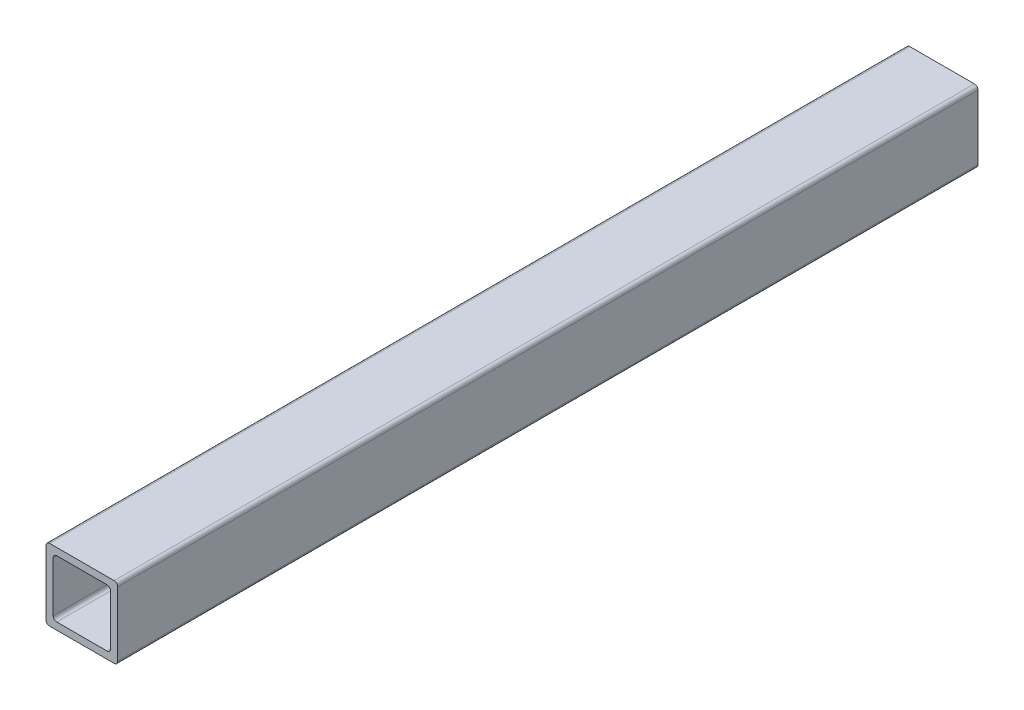
from build123d import *

# Parameters (mm, degrees)
BOSS_EXTRU_1_DEPTH = 480


with BuildPart() as part:
    # Esquisse2 → Boss.-Extru.1 (new body)
    with BuildSketch(Plane.XY):
        with BuildLine():
            Line((2, 0), (38, 0))
            ThreePointArc((38, 0), (39.414213562, 0.585786438), (40, 2))
            Line((40, 2), (40, 38))
            ThreePointArc((40, 38), (39.414213562, 39.414213562), (38, 40))
            Line((38, 40), (2, 40))
            ThreePointArc((2, 40), (0.585786438, 39.414213562), (0, 38))
            Line((0, 38), (0, 2))
            ThreePointArc((0, 2), (0.585786438, 0.585786438), (2, 0))
        make_face()
        with BuildLine():
            Line((6, 4), (34, 4))
            ThreePointArc((34, 4), (35.414213562, 4.585786438), (36, 6))
            Line((36, 6), (36, 34))
            ThreePointArc((36, 34), (35.414213562, 35.414213562), (34, 36))
            Line((34, 36), (6, 36))
            ThreePointArc((6, 36), (4.585786438, 35.414213562), (4, 34))
            Line((4, 34), (4, 6))
            ThreePointArc((4, 6), (4.585786438, 4.585786438), (6, 4))
        make_face(mode=Mode.SUBTRACT)
    extrude(amount=BOSS_EXTRU_1_DEPTH)


solid = part.part
